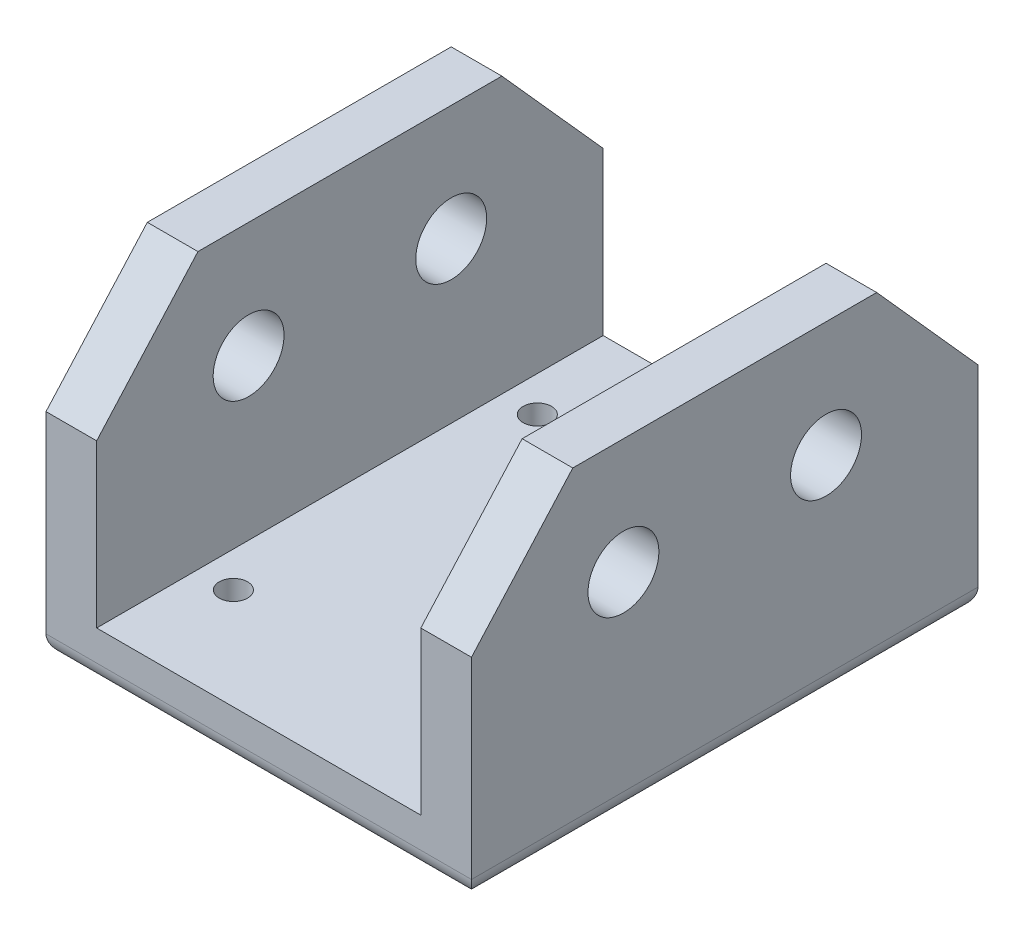
from build123d import *

# Parameters (mm, degrees)
SKETCH1_W           = 63.5
SKETCH1_H           = 6.35
BOSS_EXTRUDE1_DEPTH = 53.34
BOSS_EXTRUDE2_DEPTH = 6.35
CUT_EXTRUDE1_REACH  = 94.454
SKETCH11_R          = 4.445
FILLET1_R           = 2.54
CUT_EXTRUDE2_REACH  = 94.454
SKETCH19_R          = 1.778


with BuildPart() as part:
    # Sketch1 → Boss-Extrude1 (new body)
    with BuildSketch(Plane(origin=(0, 0, 0), x_dir=(0, 0, -1), z_dir=(1, 0, 0))):
        with Locations((31.75, 3.175)):
            Rectangle(SKETCH1_W, SKETCH1_H)
    extrude(amount=-BOSS_EXTRUDE1_DEPTH)

    # Sketch2 → Boss-Extrude2 (add)
    with BuildSketch(Plane(origin=(0, 0, 0), x_dir=(0, 0, -1), z_dir=(1, 0, 0))):
        Polygon((0, 6.35), (0, 26.67), (12.7, 40.869031657), (50.8, 40.869031657), (63.5, 26.67), (63.5, 6.35), align=None)
    boss_extrude2 = extrude(amount=-BOSS_EXTRUDE2_DEPTH)

    # Sketch11 → Cut-Extrude1 (cut, up to next)
    with BuildSketch(Plane(origin=(0, 0, 0), x_dir=(0, 0, -1), z_dir=(1, 0, 0)), mode=Mode.PRIVATE) as cut_extrude1_sk1:
        with Locations((19.05, 26.391031657)):
            Circle(SKETCH11_R)
    cut_extrude1_tool1 = extrude(cut_extrude1_sk1.sketch, amount=-CUT_EXTRUDE1_REACH, mode=Mode.PRIVATE) & part.part
    # Sketch11 → Cut-Extrude1 (cut, up to next)
    with BuildSketch(Plane(origin=(0, 0, 0), x_dir=(0, 0, -1), z_dir=(1, 0, 0)), mode=Mode.PRIVATE) as cut_extrude1_sk2:
        with Locations((44.45, 26.391031657)):
            Circle(SKETCH11_R)
    cut_extrude1_tool2 = extrude(cut_extrude1_sk2.sketch, amount=-CUT_EXTRUDE1_REACH, mode=Mode.PRIVATE) & part.part
    cut_extrude1_1 = cut_extrude1_tool1.solids().sort_by_distance((0, 26.391032, -19.05))[0]
    add(cut_extrude1_1, mode=Mode.SUBTRACT)
    cut_extrude1_2 = cut_extrude1_tool2.solids().sort_by_distance((0, 26.391032, -44.45))[0]
    add(cut_extrude1_2, mode=Mode.SUBTRACT)
    cut_extrude1 = cut_extrude1_1 + cut_extrude1_2  # Cut-Extrude1 as one shape, for the pattern or mirror that repeats it

    # Fillet1
    fillet1_edges = [part.edges().sort_by_distance(p)[0] for p in [
        (0, 0, -31.75),
        (-53.34, 0, -31.75),
        (-26.67, 0, -63.5),
        (-26.67, 0, 0),
    ]]
    fillet(fillet1_edges, radius=FILLET1_R)

    # Sketch19 → Cut-Extrude2 (cut, up to next)
    with BuildSketch(Plane.XZ, mode=Mode.PRIVATE) as cut_extrude2_sk1:
        with Locations(Location((-10.795, -50.8, 0), (0, 0, 270))):
            Circle(SKETCH19_R)
    cut_extrude2_tool1 = extrude(cut_extrude2_sk1.sketch, amount=-CUT_EXTRUDE2_REACH, mode=Mode.PRIVATE) & part.part
    # Sketch19 → Cut-Extrude2 (cut, up to next)
    with BuildSketch(Plane.XZ, mode=Mode.PRIVATE) as cut_extrude2_sk2:
        with Locations(Location((-42.545, -50.8, 0), (0, 0, 270))):
            Circle(SKETCH19_R)
    cut_extrude2_tool2 = extrude(cut_extrude2_sk2.sketch, amount=-CUT_EXTRUDE2_REACH, mode=Mode.PRIVATE) & part.part
    # Sketch19 → Cut-Extrude2 (cut, up to next)
    with BuildSketch(Plane.XZ, mode=Mode.PRIVATE) as cut_extrude2_sk3:
        with Locations(Location((-42.545, -12.7, 0), (0, 0, 270))):
            Circle(SKETCH19_R)
    cut_extrude2_tool3 = extrude(cut_extrude2_sk3.sketch, amount=-CUT_EXTRUDE2_REACH, mode=Mode.PRIVATE) & part.part
    # Sketch19 → Cut-Extrude2 (cut, up to next)
    with BuildSketch(Plane.XZ, mode=Mode.PRIVATE) as cut_extrude2_sk4:
        with Locations(Location((-10.795, -12.7, 0), (0, 0, 270))):
            Circle(SKETCH19_R)
    cut_extrude2_tool4 = extrude(cut_extrude2_sk4.sketch, amount=-CUT_EXTRUDE2_REACH, mode=Mode.PRIVATE) & part.part
    add(cut_extrude2_tool1.solids().sort_by_distance((-10.795, 0, -50.8))[0], mode=Mode.SUBTRACT)
    add(cut_extrude2_tool2.solids().sort_by_distance((-42.545, 0, -50.8))[0], mode=Mode.SUBTRACT)
    add(cut_extrude2_tool3.solids().sort_by_distance((-42.545, 0, -12.7))[0], mode=Mode.SUBTRACT)
    add(cut_extrude2_tool4.solids().sort_by_distance((-10.795, 0, -12.7))[0], mode=Mode.SUBTRACT)

    # Mirror1: Boss-Extrude2, Cut-Extrude1 across plane
    add(boss_extrude2.mirror(Plane(origin=(-26.67, 0, 0), x_dir=(0, 0, 1), z_dir=(1, 0, 0))))
    add(cut_extrude1.mirror(Plane(origin=(-26.67, 0, 0), x_dir=(0, 0, 1), z_dir=(1, 0, 0))), mode=Mode.SUBTRACT)


solid = part.part
